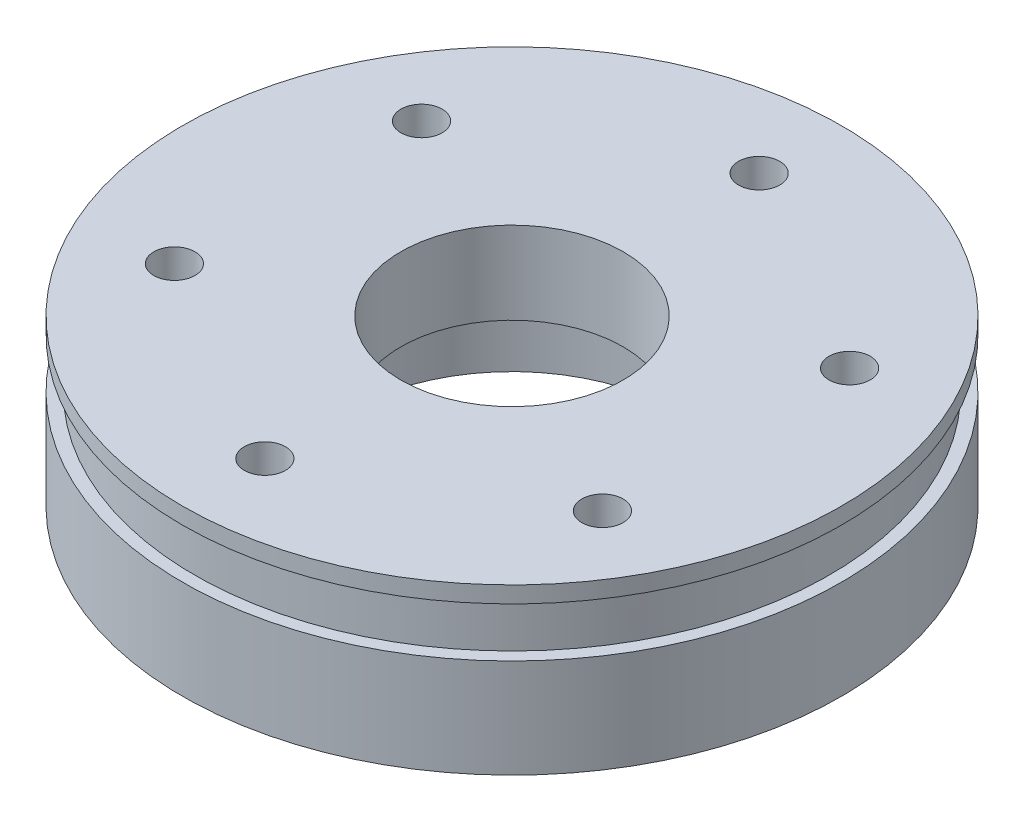
from build123d import *

# Parameters (mm, degrees)
SKETCH1_R                = 38.515
BOSS_EXTRUDE1_DEPTH      = 10
SKETCH2_R                = 40
BOSS_EXTRUDE2_DEPTH      = 2
BOSS_EXTRUDE3_DEPTH      = 10
BOSS_EXTRUDE3_DEPTH_BACK = 2
SKETCH3_R                = 40
SKETCH4_R                = 13.5
SKETCH4_R_2              = 2.5
CUT_EXTRUDE1_DEPTH       = 61
SKETCH5_R                = 20
CUT_EXTRUDE2_DEPTH       = 10


with BuildPart() as part:
    # Sketch1 → Boss-Extrude1 (new body)
    with BuildSketch(Plane(origin=(0, 0, 0), x_dir=(1, 0, 0), z_dir=(0, 1, 0))):
        with Locations(Location((0, 0, 0), (0, 0, 270))):
            Circle(SKETCH1_R)
    extrude(amount=BOSS_EXTRUDE1_DEPTH)

    # Sketch2 → Boss-Extrude2 (add)
    with BuildSketch(Plane(origin=(0, 10, 0), x_dir=(1, 0, 0), z_dir=(0, 1, 0))):
        with Locations(Location((0, 0, 0), (0, 0, 270))):
            Circle(SKETCH2_R)
    extrude(amount=-BOSS_EXTRUDE2_DEPTH)

    # Sketch3 → Boss-Extrude3 (add, two sides: drawn at the far end of the back side and taken through both)
    with BuildSketch(Plane.XZ.offset(-BOSS_EXTRUDE3_DEPTH_BACK)):
        with Locations(Location((0, 0, 0), (0, 0, 90))):
            Circle(SKETCH3_R)
    extrude(amount=BOSS_EXTRUDE3_DEPTH + BOSS_EXTRUDE3_DEPTH_BACK)

    # Sketch4 → Cut-Extrude1 (cut, through all)
    with BuildSketch(Plane.XZ.offset(10)):
        with Locations(Location((0, 0, 0), (0, 0, 270))):
            Circle(SKETCH4_R)
        with Locations(Location((0, 30, 0), (0, 0, 270))):
            Circle(SKETCH4_R_2)
        with Locations(Location((25.980762114, 15, 0), (0, 0, 270))):
            Circle(SKETCH4_R_2)
        with Locations(Location((25.980762114, -15, 0), (0, 0, 270))):
            Circle(SKETCH4_R_2)
        with Locations(Location((0, -30, 0), (0, 0, 270))):
            Circle(SKETCH4_R_2)
        with Locations(Location((-25.980762114, -15, 0), (0, 0, 270))):
            Circle(SKETCH4_R_2)
        with Locations(Location((-25.980762114, 15, 0), (0, 0, 270))):
            Circle(SKETCH4_R_2)
    extrude(amount=-CUT_EXTRUDE1_DEPTH, mode=Mode.SUBTRACT)

    # Sketch5 → Cut-Extrude2 (cut)
    with BuildSketch(Plane.XZ.offset(10)):
        with Locations(Location((0, 0, 0), (0, 0, 270))):
            Circle(SKETCH5_R)
    extrude(amount=-CUT_EXTRUDE2_DEPTH, mode=Mode.SUBTRACT)


solid = part.part
